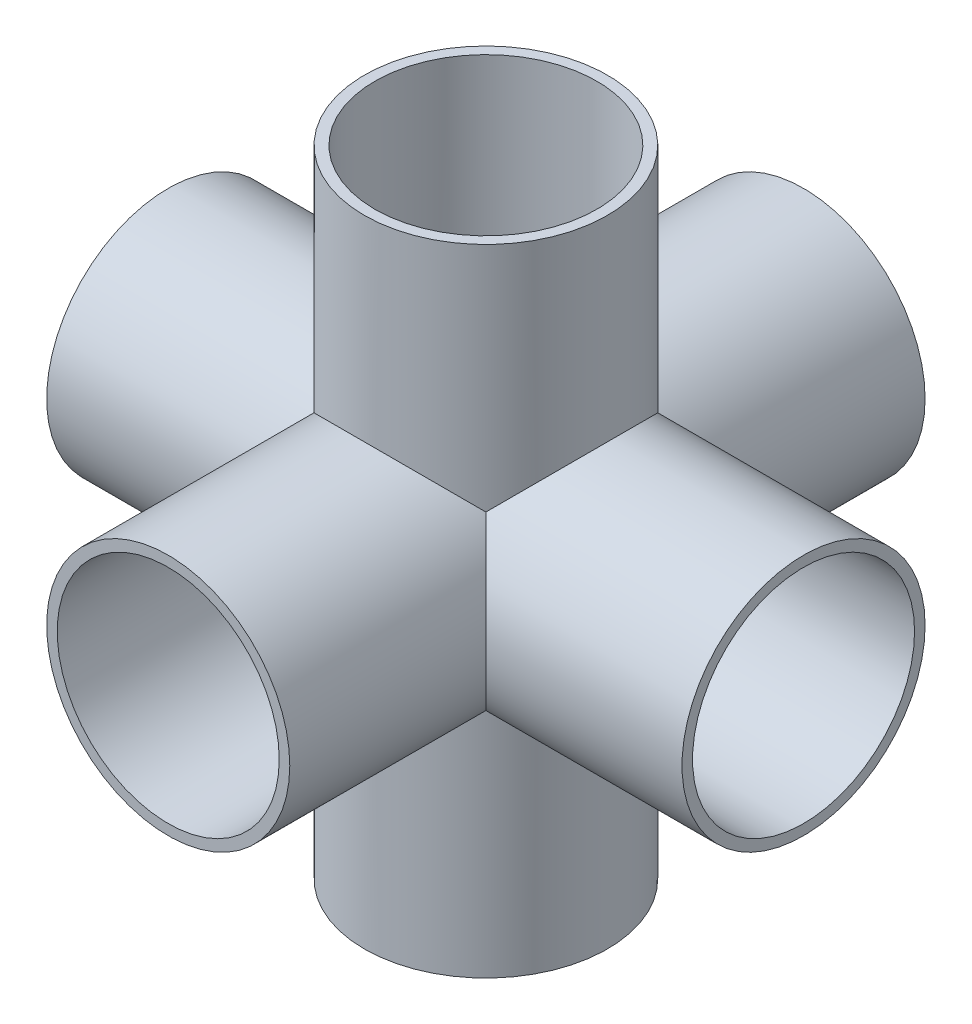
from build123d import *

# Parameters (mm, degrees)
EXTRUDE1_DEPTH          = 49.784
EXTRUDE1_DEPTH_BACK     = 49.784
SKETCH1_R               = 19.05
EXTRUDE2_DEPTH          = 49.784
EXTRUDE2_DEPTH_BACK     = 49.784
SKETCH2_R               = 19.05
EXTRUDE3_DEPTH          = 49.784
EXTRUDE3_DEPTH_BACK     = 49.784
SKETCH3_R               = 19.05
CUT_EXTRUDE1_DEPTH      = 87.228417404
CUT_EXTRUDE1_DEPTH_BACK = 87.228417404
SKETCH4_R               = 17.399
CUT_EXTRUDE2_DEPTH      = 87.228417404
CUT_EXTRUDE2_DEPTH_BACK = 87.228417404
SKETCH5_R               = 17.399
CUT_EXTRUDE3_DEPTH      = 87.228417404
CUT_EXTRUDE3_DEPTH_BACK = 87.228417404
SKETCH6_R               = 17.399


with BuildPart() as part:
    # Sketch1 → Extrude1 (new, two sides: drawn at the far end of the back side and taken through both)
    with BuildSketch(Plane(origin=(0, 0, 0), x_dir=(1, 0, 0), z_dir=(0, 1, 0)).offset(-EXTRUDE1_DEPTH_BACK)):
        with Locations(Location((0, 0, 0), (0, 0, 270))):
            Circle(SKETCH1_R)
    extrude(amount=EXTRUDE1_DEPTH + EXTRUDE1_DEPTH_BACK)

    # Sketch2 → Extrude2 (add, two sides: drawn at the far end of the back side and taken through both)
    with BuildSketch(Plane.XY.offset(-EXTRUDE2_DEPTH_BACK)):
        Circle(SKETCH2_R)
    extrude(amount=EXTRUDE2_DEPTH + EXTRUDE2_DEPTH_BACK)

    # Sketch3 → Extrude3 (add, two sides: drawn at the far end of the back side and taken through both)
    with BuildSketch(Plane(origin=(0, 0, 0), x_dir=(0, 0, -1), z_dir=(1, 0, 0)).offset(-EXTRUDE3_DEPTH_BACK)):
        Circle(SKETCH3_R)
    extrude(amount=EXTRUDE3_DEPTH + EXTRUDE3_DEPTH_BACK)

    # Sketch4 → Cut-Extrude1 (cut, two sides: drawn at the far end of the back side and taken through both)
    with BuildSketch(Plane(origin=(0, 0, 0), x_dir=(1, 0, 0), z_dir=(0, 1, 0)).offset(-CUT_EXTRUDE1_DEPTH_BACK)):
        with Locations(Location((0, 0, 0), (0, 0, 270))):
            Circle(SKETCH4_R)
    extrude(amount=CUT_EXTRUDE1_DEPTH + CUT_EXTRUDE1_DEPTH_BACK, mode=Mode.SUBTRACT)

    # Sketch5 → Cut-Extrude2 (cut, two sides: drawn at the far end of the back side and taken through both)
    with BuildSketch(Plane(origin=(0, 0, 0), x_dir=(0, 0, -1), z_dir=(1, 0, 0)).offset(-CUT_EXTRUDE2_DEPTH_BACK)):
        Circle(SKETCH5_R)
    extrude(amount=CUT_EXTRUDE2_DEPTH + CUT_EXTRUDE2_DEPTH_BACK, mode=Mode.SUBTRACT)

    # Sketch6 → Cut-Extrude3 (cut, two sides: drawn at the far end of the back side and taken through both)
    with BuildSketch(Plane.XY.offset(-CUT_EXTRUDE3_DEPTH_BACK)):
        Circle(SKETCH6_R)
    extrude(amount=CUT_EXTRUDE3_DEPTH + CUT_EXTRUDE3_DEPTH_BACK, mode=Mode.SUBTRACT)


solid = part.part
